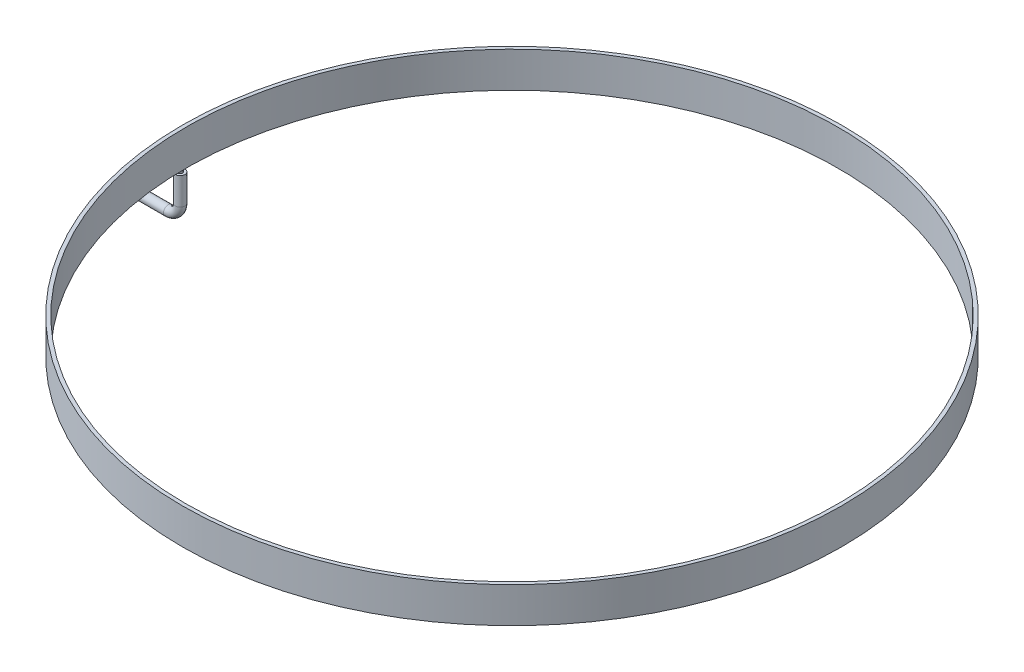
from build123d import *

# Parameters (mm, degrees)
SKETCH1_R           = 27.8
SKETCH1_R_2         = 27.5
BOSS_EXTRUDE1_DEPTH = 1.5
SWEEP1_PROFILE_R    = 0.2
SKETCH33_R          = 0.4
BOSS_EXTRUDE2_DEPTH = 1
SWEEP2_PROFILE_R    = 0.4


with BuildPart() as part:
    # Sketch1 → Boss-Extrude1 (new, symmetric)
    with BuildSketch(Plane(origin=(0, 0, 0), x_dir=(1, 0, 0), z_dir=(0, 1, 0))):
        with Locations(Location((0, 0, 0), (0, 0, 270))):
            Circle(SKETCH1_R)
        with Locations(Location((0, 0, 0), (0, 0, 270))):
            Circle(SKETCH1_R_2, mode=Mode.SUBTRACT)
    extrude(amount=BOSS_EXTRUDE1_DEPTH, both=True)


with BuildPart() as body_2:
    # Sweep1: sweep along a path in Sketch2
    with BuildLine(Plane.XY) as sweep1_path:
        Line((-27.98, -1), (-27.98, -2))
    # Sweep1 profile (on start of the path) → Sweep1 (sweep)
    with BuildSketch(Plane(origin=(-27.98, -1, 0), x_dir=(0, 0, -1), z_dir=(0, -1, 0))):
        Circle(SWEEP1_PROFILE_R)
    sweep(path=sweep1_path.line)

    # Sketch33 → Boss-Extrude2 (add)
    with BuildSketch(Plane.XZ.offset(2)):
        with Locations(Location((-27.98, 0, 0), (0, 0, 270))):
            Circle(SKETCH33_R)
    extrude(amount=BOSS_EXTRUDE2_DEPTH)

    # Sweep2: sweep along a path in Sketch34
    with BuildLine(Plane.XY) as sweep2_path:
        Line((-27.98, -2), (-27.98, -4.3))
        ThreePointArc((-27.98, -4.3), (-28.272893219, -5.007106781), (-28.98, -5.3))
        Line((-28.98, -5.3), (-32.98, -5.3))
    # Sweep2 profile (on start of the path) → Sweep2 (sweep)
    with BuildSketch(Plane(origin=(-27.98, -2, 0), x_dir=(0, 0, -1), z_dir=(0, -1, 0))):
        Circle(SWEEP2_PROFILE_R)
    sweep(path=sweep2_path.line)


solid = Compound([part.part, body_2.part])
